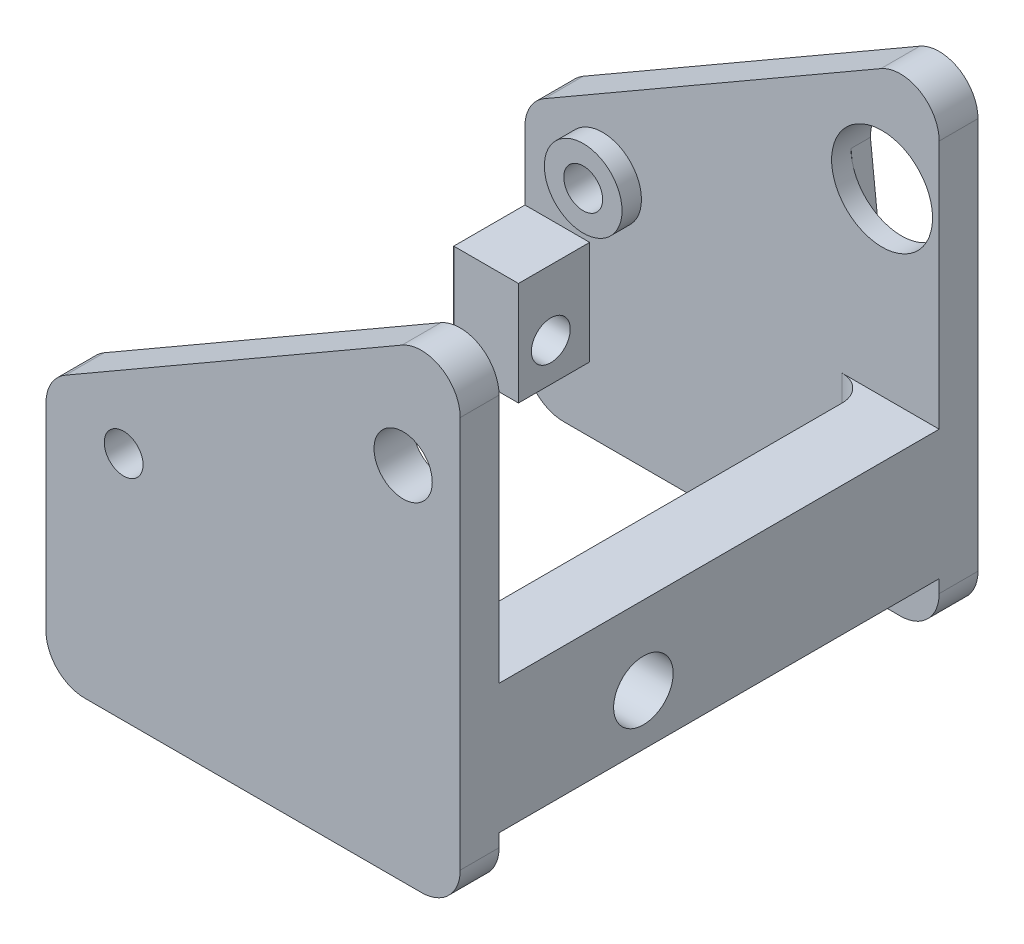
from build123d import *

# Parameters (mm, degrees)
SKETCH1_R           = 1.5
BOSS_EXTRUDE1_DEPTH = 3
SKETCH2_W           = 5
SKETCH2_H           = 8
BOSS_EXTRUDE2_DEPTH = 34
LPATTERN1_COUNT     = 2
LPATTERN1_PITCH     = 37
SKETCH3_W           = 5.5
SKETCH3_H           = 10
BOSS_EXTRUDE4_DEPTH = 34
SKETCH5_W           = 23
SKETCH5_H           = 8
CUT_EXTRUDE1_DEPTH  = 10
CUT_EXTRUDE11_START = -3.7
SKETCH9_R           = 1.5
CUT_EXTRUDE11_DEPTH = 2.2
SKETCH11_R          = 3
SKETCH11_R_2        = 1.5
BOSS_EXTRUDE5_DEPTH = 1.5
SKETCH12_R          = 1.5
CUT_EXTRUDE13_DEPTH = 62.719864532
SKETCH14_R          = 3.9
CUT_EXTRUDE15_DEPTH = 10
SKETCH15_R          = 2.3
CUT_EXTRUDE16_DEPTH = 65.065136212
SKETCH16_R          = 2.25
CUT_EXTRUDE17_DEPTH = 65.065136212
FILLET1_R           = 2


with BuildPart() as part:
    # Sketch1 → Boss-Extrude1 (new body)
    with BuildSketch(Plane.XY):
        with BuildLine():
            Line((-4.5, -2.598076211), (-30.5, -17.60918321))
            ThreePointArc((-30.5, -17.60918321), (-31.598076211, -18.707259422), (-32, -20.207259422))
            Line((-32, -20.207259422), (-32, -35.475208614))
            ThreePointArc((-32, -35.475208614), (-31.121320344, -37.596528958), (-29, -38.475208614))
            Line((-29, -38.475208614), (-3, -38.475208614))
            ThreePointArc((-3, -38.475208614), (-0.878679656, -37.596528958), (0, -35.475208614))
            Line((0, -35.475208614), (0, -5.196152423))
            ThreePointArc((0, -5.196152423), (-1.5, -2.598076211), (-4.5, -2.598076211))
        make_face()
        with Locations((-26, -20.60918321)):
            Circle(SKETCH1_R, mode=Mode.SUBTRACT)
        with Locations((-4.41, -10.598076211)):
            Circle(SKETCH1_R, mode=Mode.SUBTRACT)
    boss_extrude1 = extrude(amount=BOSS_EXTRUDE1_DEPTH)

    # Sketch2 → Boss-Extrude2 (add)
    with BuildSketch(Plane.XY.offset(3)):
        with Locations((-29.5, -29.475208614)):
            Rectangle(SKETCH2_W, SKETCH2_H)
    extrude(amount=BOSS_EXTRUDE2_DEPTH)

    # LPattern1: Boss-Extrude1 ×2
    with Locations(*[(0, 0, i * LPATTERN1_PITCH) for i in range(1, LPATTERN1_COUNT)]):
        add(boss_extrude1)

    # Sketch3 → Boss-Extrude4 (add)
    with BuildSketch(Plane.XY.offset(3)):
        with Locations((-2.75, -29.475208614)):
            Rectangle(SKETCH3_W, SKETCH3_H)
    extrude(amount=BOSS_EXTRUDE4_DEPTH)

    # Sketch5 → Cut-Extrude1 (cut)
    with BuildSketch(Plane.ZY.offset(32)):
        with Locations((20, -29.475208614)):
            Rectangle(SKETCH5_W, SKETCH5_H)
    extrude(amount=-CUT_EXTRUDE1_DEPTH, mode=Mode.SUBTRACT)

    # Sketch9 → Cut-Extrude11 (cut)
    # profile 1 of 2: a face of its own
    with BuildSketch(Plane.XY.offset(3).offset(CUT_EXTRUDE11_START)):
        with BuildLine():
            Line((-8.22147541, -11.42430572), (-6.51, -27.398076211))
            ThreePointArc((-6.51, -27.398076211), (-6.240163927, -28.427882018), (-5.5, -29.193041392))
            Line((-5.5, -29.193041392), (-5.5, -24.475208614))
            Line((-5.5, -24.475208614), (-1.996835615, -24.475208614))
            Line((-1.996835615, -24.475208614), (-0.59852459, -11.42430572))
            Line((-0.59852459, -11.42430572), (-0.51, -10.598076211))
            ThreePointArc((-0.51, -10.598076211), (-4.41, -6.698076211), (-8.31, -10.598076211))
            Line((-8.31, -10.598076211), (-8.22147541, -11.42430572))
        make_face()
        with Locations((-4.41, -10.598076211)):
            Circle(SKETCH9_R, mode=Mode.SUBTRACT)
    # profile 2 of 2: a face of its own
    with BuildSketch(Plane.XY.offset(3).offset(CUT_EXTRUDE11_START)):
        with BuildLine():
            Line((-5.5, -24.475208614), (-5.5, -29.193041392))
            ThreePointArc((-5.5, -29.193041392), (-3.380194193, -29.228240138), (-2.31, -27.398076211))
            Line((-2.31, -27.398076211), (-1.996835615, -24.475208614))
            Line((-1.996835615, -24.475208614), (-5.5, -24.475208614))
        make_face()
    extrude(amount=CUT_EXTRUDE11_DEPTH, mode=Mode.SUBTRACT)

    # Sketch11 → Boss-Extrude5 (add)
    with BuildSketch(Plane.XY.offset(3)):
        with Locations((-26, -20.60918321)):
            Circle(SKETCH11_R)
        with Locations((-26, -20.60918321)):
            Circle(SKETCH11_R_2, mode=Mode.SUBTRACT)
    extrude(amount=BOSS_EXTRUDE5_DEPTH)

    # Sketch12 → Cut-Extrude13 (cut, through all)
    with BuildSketch(Plane(origin=(-27, 0, 0), x_dir=(0, 0, -1), z_dir=(1, 0, 0))):
        with Locations((-34.4, -30.525208614)):
            Circle(SKETCH12_R)
        with Locations((-6, -30.525208614)):
            Circle(SKETCH12_R)
    extrude(amount=-CUT_EXTRUDE13_DEPTH, mode=Mode.SUBTRACT)

    # Sketch14 → Cut-Extrude15 (cut)
    with BuildSketch(Plane(origin=(0, 0, 1.5), x_dir=(-1, 0, 0), z_dir=(0, 0, -1))):
        with Locations(Location((4.41, -10.598076211, 0), (0, 0, 180))):
            Circle(SKETCH14_R)
    extrude(amount=-CUT_EXTRUDE15_DEPTH, mode=Mode.SUBTRACT)

    # Sketch15 → Cut-Extrude16 (cut, through all)
    with BuildSketch(Plane(origin=(0, 0, 0), x_dir=(0, 0, -1), z_dir=(1, 0, 0))):
        with Locations(Location((-25.85, -30.525208614, 0), (0, 0, 90))):
            Circle(SKETCH15_R)
    extrude(amount=-CUT_EXTRUDE16_DEPTH, mode=Mode.SUBTRACT)

    # Sketch16 → Cut-Extrude17 (cut, through all)
    with BuildSketch(Plane.XY.offset(40)):
        with Locations((-4.41, -10.598076211)):
            Circle(SKETCH16_R)
    extrude(amount=-CUT_EXTRUDE17_DEPTH, mode=Mode.SUBTRACT)

    # Fillet1
    fillet1_edges = [part.edges().sort_by_distance(p)[0] for p in [
        (-5.5, -29.475208614, 3),
        (-5.5, -29.475208614, 37),
    ]]
    fillet(fillet1_edges, radius=FILLET1_R)


solid = part.part
